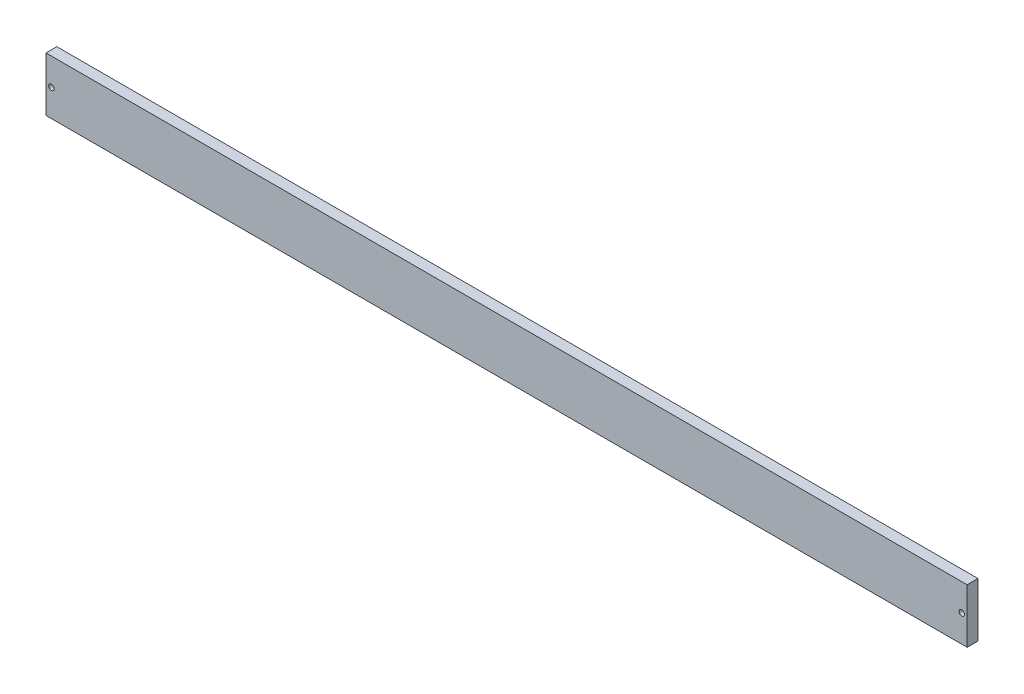
from build123d import *

# Parameters (mm, degrees)
CROQUIS1_W              = 850
CROQUIS1_H              = 50
SALIENTE_EXTRUIR1_DEPTH = 5
CROQUIS2_R              = 2.5
CORTAR_EXTRUIR1_DEPTH   = 5
CORTAR_EXTRUIR3_START   = -5
CROQUIS4_R              = 2.5
CORTAR_EXTRUIR3_DEPTH   = 5


with BuildPart() as part:
    # Croquis1 → Saliente-Extruir1 (new, symmetric)
    with BuildSketch(Plane.XY):
        Rectangle(CROQUIS1_W, CROQUIS1_H)
    extrude(amount=SALIENTE_EXTRUIR1_DEPTH, both=True)

    # Croquis2 → Cortar-Extruir1 (cut)
    with BuildSketch(Plane.XZ.offset(25)):
        with Locations(Location((-375, 0, 0), (0, 0, 270))):
            Circle(CROQUIS2_R)
        with Locations(Location((-275, 0, 0), (0, 0, 270))):
            Circle(CROQUIS2_R)
        with Locations(Location((-175, 0, 0), (0, 0, 270))):
            Circle(CROQUIS2_R)
        with Locations(Location((-75, 0, 0), (0, 0, 270))):
            Circle(CROQUIS2_R)
        with Locations(Location((25, 0, 0), (0, 0, 270))):
            Circle(CROQUIS2_R)
        with Locations(Location((125, 0, 0), (0, 0, 270))):
            Circle(CROQUIS2_R)
        with Locations(Location((225, 0, 0), (0, 0, 270))):
            Circle(CROQUIS2_R)
        with Locations(Location((325, 0, 0), (0, 0, 270))):
            Circle(CROQUIS2_R)
    extrude(amount=-CORTAR_EXTRUIR1_DEPTH, mode=Mode.SUBTRACT)

    # Croquis4 → Cortar-Extruir3 (cut)
    with BuildSketch(Plane(origin=(0, 0, -5), x_dir=(-1, 0, 0), z_dir=(0, 0, -1)).offset(CORTAR_EXTRUIR3_START)):
        with Locations((-420, 0)):
            Circle(CROQUIS4_R)
        with Locations(Location((420, 0, 0), (0, 0, 180))):
            Circle(CROQUIS4_R)
    extrude(amount=-CORTAR_EXTRUIR3_DEPTH, mode=Mode.SUBTRACT)


solid = part.part
